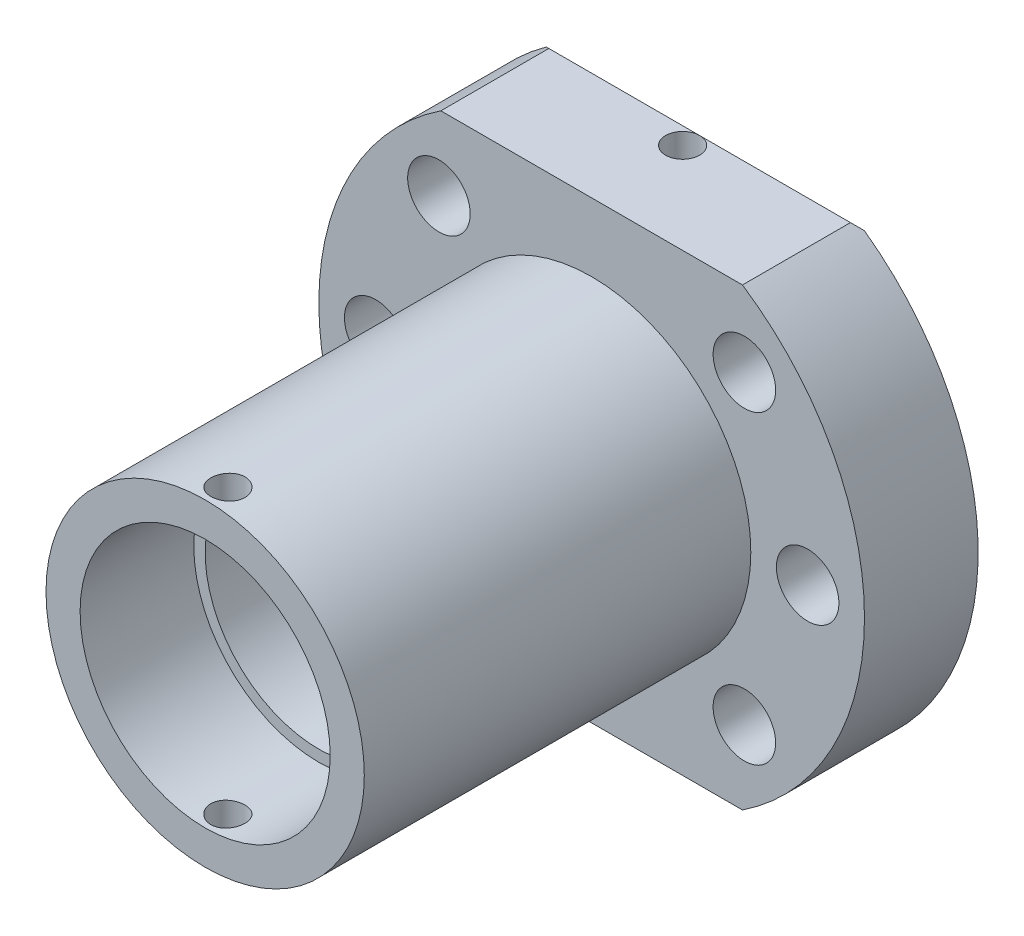
from build123d import *

# Parameters (mm, degrees)
SKETCH1_R           = 2.75
SKETCH1_R_2         = 14
BOSS_EXTRUDE1_DEPTH = 10
SKETCH1_3_R         = 14
SKETCH1_3_R_2       = 11
SKETCH1_3_R_3       = 10
BOSS_EXTRUDE2_DEPTH = 24
BOSS_EXTRUDE3_START = 10
SKETCH3_R           = 14
SKETCH3_R_2         = 11
BOSS_EXTRUDE3_DEPTH = 10
CHAMFER1_SIZE       = 0.5
SKETCH4_R           = 1.5
CUT_EXTRUDE1_DEPTH  = 58.723478759


with BuildPart() as part:
    # Sketch1 → Boss-Extrude1 (new body)
    with BuildSketch(Plane.XY):
        with BuildLine():
            Line((-13.266499161, -20), (13.266499161, -20))
            ThreePointArc((13.266499161, -20), (24, 0), (13.266499161, 20))
            Line((13.266499161, 20), (-13.266499161, 20))
            ThreePointArc((-13.266499161, 20), (-24, 0), (-13.266499161, -20))
        make_face()
        with Locations((-19, 0)):
            Circle(SKETCH1_R, mode=Mode.SUBTRACT)
        with Locations((13.435028843, 13.435028843)):
            Circle(SKETCH1_R, mode=Mode.SUBTRACT)
        with Locations((13.435028843, -13.435028843)):
            Circle(SKETCH1_R, mode=Mode.SUBTRACT)
        with Locations((19, 0)):
            Circle(SKETCH1_R, mode=Mode.SUBTRACT)
        Circle(SKETCH1_R_2, mode=Mode.SUBTRACT)
        with Locations((-13.435028843, -13.435028843)):
            Circle(SKETCH1_R, mode=Mode.SUBTRACT)
        with Locations((-13.435028843, 13.435028843)):
            Circle(SKETCH1_R, mode=Mode.SUBTRACT)
    extrude(amount=-BOSS_EXTRUDE1_DEPTH)

    # Chamfer1
    chamfer1_edges = [part.edges().sort_by_distance(p)[0] for p in [
        (0, -20, -10),
        (0, 20, -10),
    ]]
    chamfer(chamfer1_edges, length=CHAMFER1_SIZE)


with BuildPart() as body_2:
    # Sketch1<3> → Boss-Extrude2 (new body)
    # profile 1 of 2: a face of its own
    with BuildSketch(Plane.XY):
        Circle(SKETCH1_3_R)
        Circle(SKETCH1_3_R_2, mode=Mode.SUBTRACT)
    # profile 2 of 2: a face of its own
    with BuildSketch(Plane.XY):
        Circle(SKETCH1_3_R_2)
        Circle(SKETCH1_3_R_3, mode=Mode.SUBTRACT)
    extrude(amount=BOSS_EXTRUDE2_DEPTH)

    # Sketch3 → Boss-Extrude3 (add)
    with BuildSketch(Plane.XY.offset(24).offset(BOSS_EXTRUDE3_START)):
        Circle(SKETCH3_R)
        Circle(SKETCH3_R_2, mode=Mode.SUBTRACT)
    extrude(amount=-BOSS_EXTRUDE3_DEPTH)


with BuildPart() as cut_extrude1_tool:
    # Sketch4 → Cut-Extrude1 (new, through all)
    with BuildSketch(Plane(origin=(0, 20, 0), x_dir=(1, 0, 0), z_dir=(0, 1, 0))):
        with Locations(Location((0, 8, 0), (0, 0, 270))):
            Circle(SKETCH4_R)
        with Locations(Location((0, -32, 0), (0, 0, 270))):
            Circle(SKETCH4_R)
    extrude(amount=-CUT_EXTRUDE1_DEPTH)


with BuildPart() as part_1:
    add(part.part)

    # Cut-Extrude1: cut by cut_extrude1_tool
    add(cut_extrude1_tool.part, mode=Mode.SUBTRACT)

    # Sketch7 → Cut-Revolve3 (revolve, cut)
    with BuildSketch(Plane.XY.offset(-5), mode=Mode.PRIVATE) as cut_revolve3_sk:
        with BuildLine():
            Line((-11.578369304, 8.043094197), (-11.76971102, 7.581154431))
            Line((-11.76971102, 7.581154431), (-7.689730302, 5.891171083))
            Line((-7.689730302, 5.891171083), (-8.646438883, 3.581472252))
            Line((-8.646438883, 3.581472252), (-23.73783256, 9.832532188))
            ThreePointArc((-23.73783256, 9.832532188), (-23.122197536, 11.203899543), (-22.427418184, 12.536917382))
            Line((-22.427418184, 12.536917382), (-11.578369304, 8.043094197))
        make_face()
    revolve(cut_revolve3_sk.sketch.rotate(Axis((-23.73783256, 9.832532188, -5), (0.9238795325112868, -0.38268343236508984, 0)), 180), axis=Axis((-23.73783256, 9.832532188, -5), (0.9238795325112868, -0.38268343236508984, 0)), mode=Mode.SUBTRACT)


with BuildPart() as body_2_1:
    add(body_2.part)

    # Cut-Extrude1: cut by cut_extrude1_tool
    add(cut_extrude1_tool.part, mode=Mode.SUBTRACT)


solid = Compound([part_1.part, body_2_1.part])
